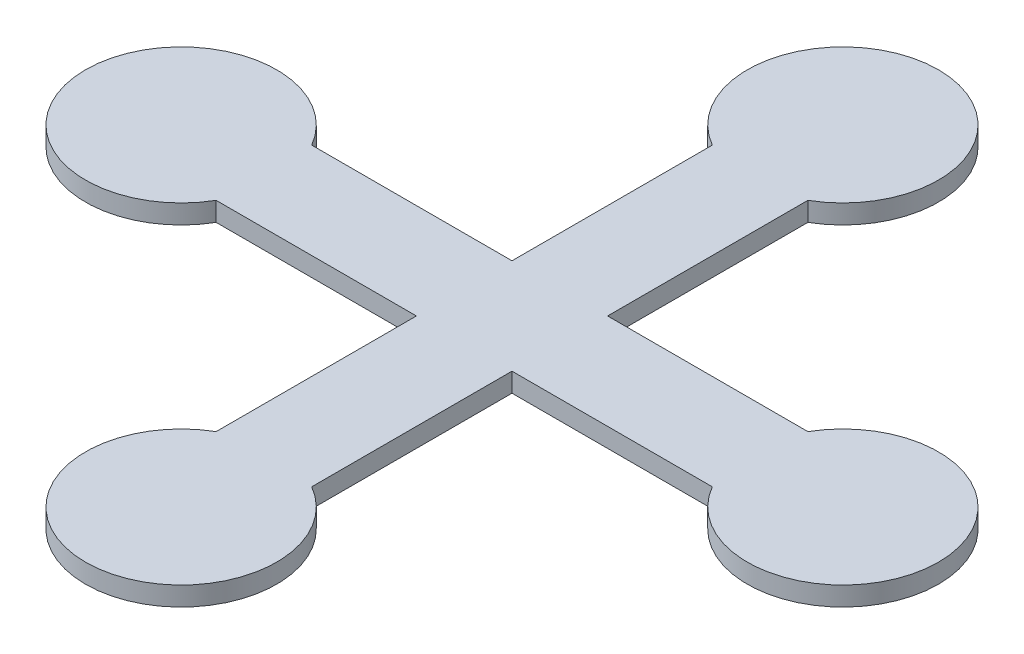
from build123d import *

# Parameters (mm, degrees)
BOSS_EXTRUDE1_DEPTH = 0.05


with BuildPart() as part:
    # Sketch1 → Boss-Extrude1 (new body)
    with BuildSketch(Plane(origin=(0, 0, 0), x_dir=(1, 0, 0), z_dir=(0, 1, 0))):
        with BuildLine():
            Line((-0.125, 0.125), (-0.125, 0.6487705))
            ThreePointArc((-0.125, 0.6487705), (0, 1.115276851), (0.125, 0.6487705))
            Line((0.125, 0.6487705), (0.125, 0.125))
            Line((0.125, 0.125), (0.6487705, 0.125))
            ThreePointArc((0.6487705, 0.125), (1.115276851, 0), (0.6487705, -0.125))
            Line((0.6487705, -0.125), (0.125, -0.125))
            Line((0.125, -0.125), (0.125, -0.6487705))
            ThreePointArc((0.125, -0.6487705), (0, -1.115276851), (-0.125, -0.6487705))
            Line((-0.125, -0.6487705), (-0.125, -0.125))
            Line((-0.125, -0.125), (-0.6487705, -0.125))
            ThreePointArc((-0.6487705, -0.125), (-1.115276851, 0), (-0.6487705, 0.125))
            Line((-0.6487705, 0.125), (-0.125, 0.125))
        make_face()
    extrude(amount=BOSS_EXTRUDE1_DEPTH)


solid = part.part
